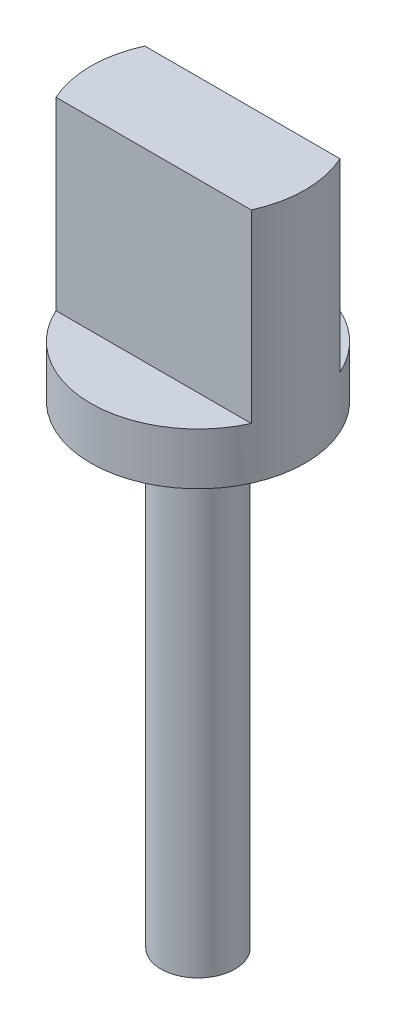
from build123d import *

# Parameters (mm, degrees)
CROQUIS1_R              = 1.45
SALIENTE_EXTRUIR1_DEPTH = 10.7
CORTAR_EXTRUIR1_START   = -6
CORTAR_EXTRUIR1_DEPTH   = 6
CROQUIS3_R              = 0.5
SALIENTE_EXTRUIR2_DEPTH = 6.4
CUT_EXTRUDE1_START      = -10
CUT_EXTRUDE1_DEPTH      = 10
SKETCH2_W               = 6.740875304
SKETCH2_H               = 8.89846687
CUT_EXTRUDE2_DEPTH      = 11.990677868


with BuildPart() as part:
    # Croquis1 → Saliente-Extruir1 (new body)
    with BuildSketch(Plane(origin=(0, 0, 0), x_dir=(1, 0, 0), z_dir=(0, 1, 0))):
        with Locations(Location((0, 0, 0), (0, 0, 270))):
            Circle(CROQUIS1_R)
    extrude(amount=SALIENTE_EXTRUIR1_DEPTH)

    # Croquis2 → Cortar-Extruir1 (cut)
    with BuildSketch(Plane(origin=(0, 10.7, 0), x_dir=(1, 0, 0), z_dir=(0, 1, 0)).offset(CORTAR_EXTRUIR1_START)):
        with BuildLine():
            Line((-1, -1.05), (1, -1.05))
            ThreePointArc((1, -1.05), (0, -1.45), (-1, -1.05))
        make_face()
    extrude(amount=CORTAR_EXTRUIR1_DEPTH, mode=Mode.SUBTRACT)

    # Croquis3 → Saliente-Extruir2 (add)
    with BuildSketch(Plane.XZ):
        with Locations(Location((0, 0, 0), (0, 0, 270))):
            Circle(CROQUIS3_R)
    extrude(amount=SALIENTE_EXTRUIR2_DEPTH)

    # Sketch1 → Cut-Extrude1 (cut)
    with BuildSketch(Plane(origin=(0, 10.7, 0), x_dir=(1, 0, 0), z_dir=(0, 1, 0)).offset(CUT_EXTRUDE1_START)):
        with BuildLine():
            Line((-1.942782437, 0.6), (1.942782437, 0.6))
            ThreePointArc((1.942782437, 0.6), (0, 2.033323289), (-1.942782437, 0.6))
        make_face()
        with BuildLine():
            Line((-1.942782437, -0.6), (1.942782437, -0.6))
            ThreePointArc((1.942782437, -0.6), (0, -2.033323289), (-1.942782437, -0.6))
        make_face()
    extrude(amount=CUT_EXTRUDE1_DEPTH, mode=Mode.SUBTRACT)

    # Sketch2 → Cut-Extrude2 (cut, through all)
    with BuildSketch(Plane.XY.offset(0.6)):
        with Locations((0.223130537, 7.649233435)):
            Rectangle(SKETCH2_W, SKETCH2_H)
    extrude(amount=-CUT_EXTRUDE2_DEPTH, mode=Mode.SUBTRACT)


solid = part.part
